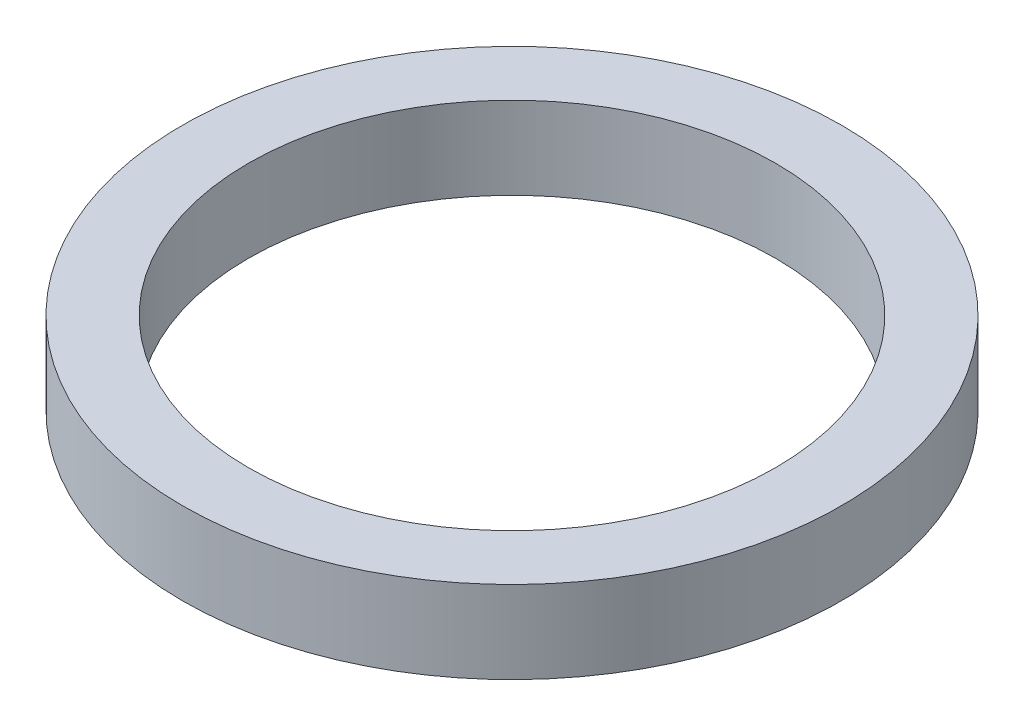
from build123d import *

# Parameters (mm, degrees)
SKETCH1_R           = 2
SKETCH1_R_2         = 1.6
BOSS_EXTRUDE1_DEPTH = 0.5


with BuildPart() as part:
    # Sketch1 → Boss-Extrude1 (new body)
    with BuildSketch(Plane(origin=(0, 0, 0), x_dir=(1, 0, 0), z_dir=(0, 1, 0))):
        with Locations(Location((0, 0, 0), (0, 0, 270))):
            Circle(SKETCH1_R)
        with Locations(Location((0, 0, 0), (0, 0, 270))):
            Circle(SKETCH1_R_2, mode=Mode.SUBTRACT)
    extrude(amount=BOSS_EXTRUDE1_DEPTH)


solid = part.part
